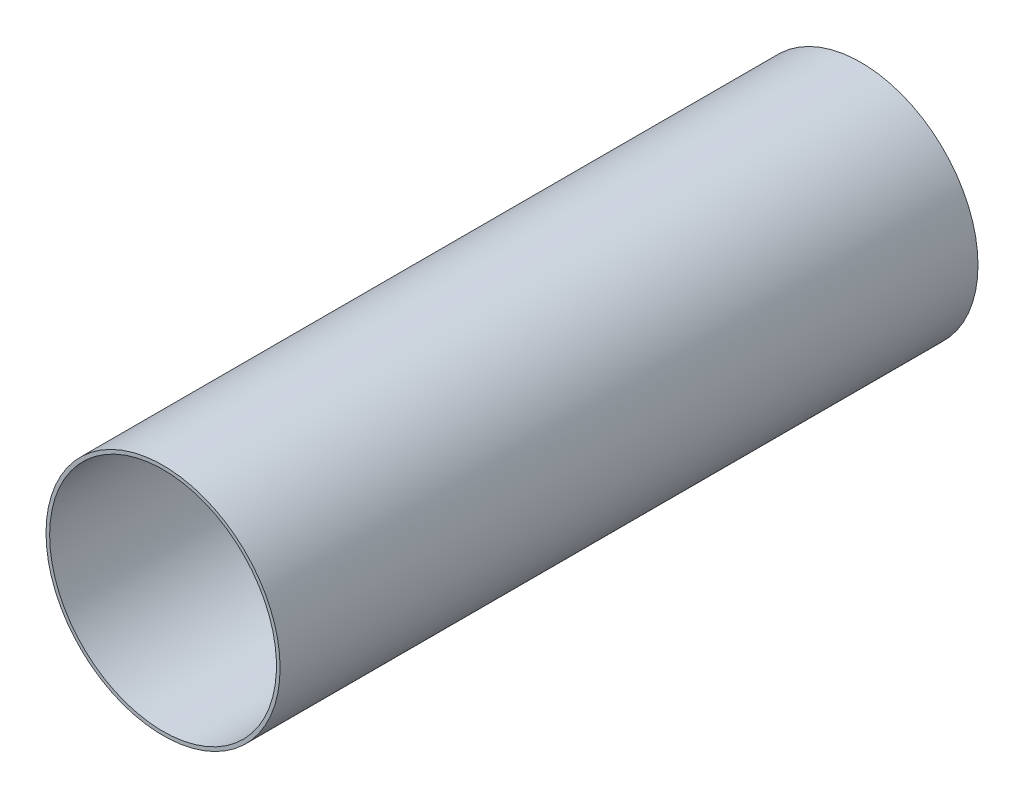
from build123d import *

# Parameters (mm, degrees)
SKETCH1_R           = 51.1175
SKETCH1_R_2         = 49.53
BOSS_EXTRUDE1_DEPTH = 304.8


with BuildPart() as part:
    # Sketch1 → Boss-Extrude1 (new body)
    with BuildSketch(Plane.XY):
        with Locations(Location((0, 0, 0), (0, 0, 180))):
            Circle(SKETCH1_R)
        with Locations(Location((0, 0, 0), (0, 0, 180))):
            Circle(SKETCH1_R_2, mode=Mode.SUBTRACT)
    extrude(amount=BOSS_EXTRUDE1_DEPTH)


solid = part.part
